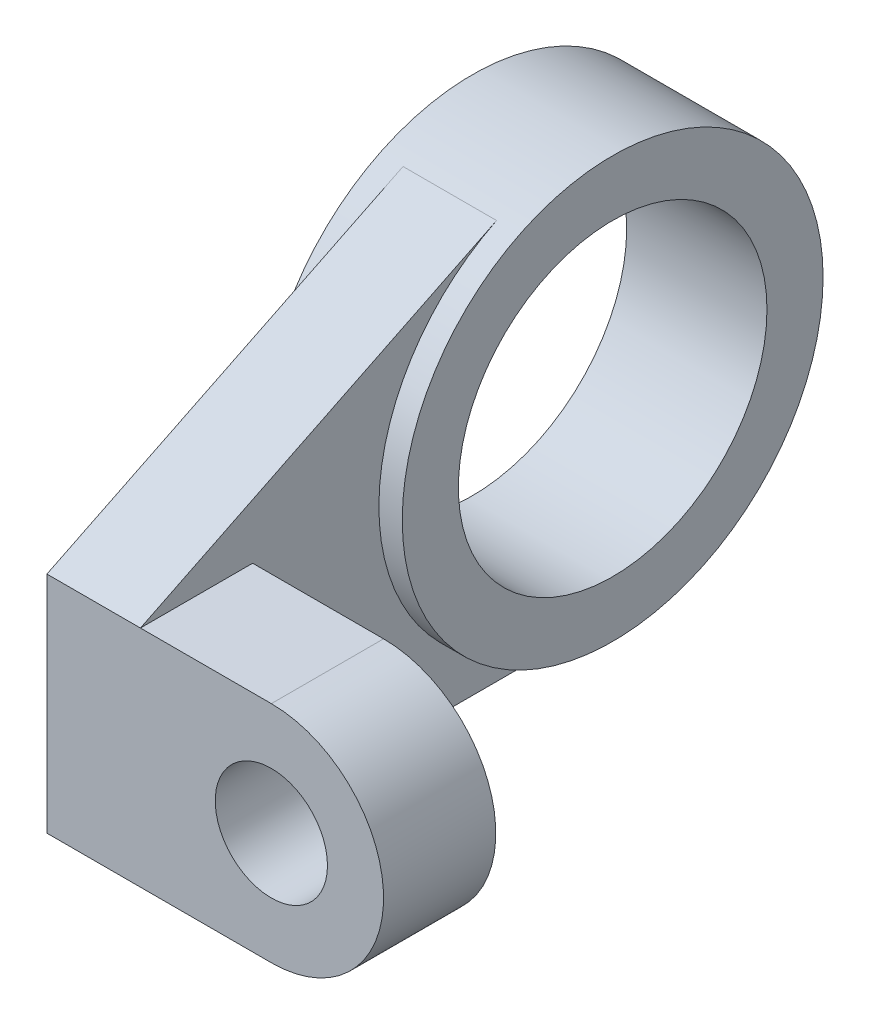
from build123d import *

# Parameters (mm, degrees)
EXTRUDE_1_DEPTH = 10
SKETCH_1_4_R    = 33.000000000000014
EXTRUDE_2_DEPTH = 15
SKETCH_2_R      = 12.000000000000005
EXTRUDE_3_DEPTH = 24


with BuildPart() as part:
    # 草圖1 → 填料-伸長1 (new, symmetric)
    with BuildSketch(Plane(origin=(0, 0, 0), x_dir=(0, 0, -1), z_dir=(1, 0, 0))):
        with BuildLine():
            Line((76.16857776208369, 37.394488386678184), (0, 0))
            Line((0, 0), (5.88e-15, -48))
            Line((5.88e-15, -48), (96, -48.00000000000001))
            ThreePointArc((95.99999999999999, -48.00000000000002), (52.166496960655074, -13.179587972985), (76.16857776208367, 37.39448838667819))
        make_face()
    extrude(amount=EXTRUDE_1_DEPTH, both=True)

    # 草圖1<4> → 填料-伸長2 (add, symmetric)
    with BuildSketch(Plane(origin=(0, 0, 0), x_dir=(0, 0, -1), z_dir=(1, 0, 0))):
        with BuildLine():
            ThreePointArc((141.00000000000003, -3.0000000000000027), (119.7969115568992, 35.19302292766466), (76.16857776208367, 37.39448838667819))
            ThreePointArc((76.16857776208367, 37.39448838667819), (52.166496960655074, -13.179587972985), (95.99999999999999, -48.00000000000002))
            ThreePointArc((95.99999999999999, -48.00000000000002), (127.81980515339464, -34.81980515339466), (141.00000000000003, -3.0000000000000138))
        make_face()
        with Locations((96, -3.0000000000000027)):
            Circle(SKETCH_1_4_R, mode=Mode.SUBTRACT)
    extrude(amount=EXTRUDE_2_DEPTH, both=True)

    # 草圖2 → 填料-伸長3 (add)
    with BuildSketch(Plane.XY):
        with BuildLine():
            Line((38, 0), (10, 0))
            Line((10, 0), (10, -48))
            Line((10, -48), (38, -48))
            ThreePointArc((38, -48), (62, -24), (38, 0))
        make_face()
        with Locations((38, -24)):
            Circle(SKETCH_2_R, mode=Mode.SUBTRACT)
    extrude(amount=-EXTRUDE_3_DEPTH)


solid = part.part
